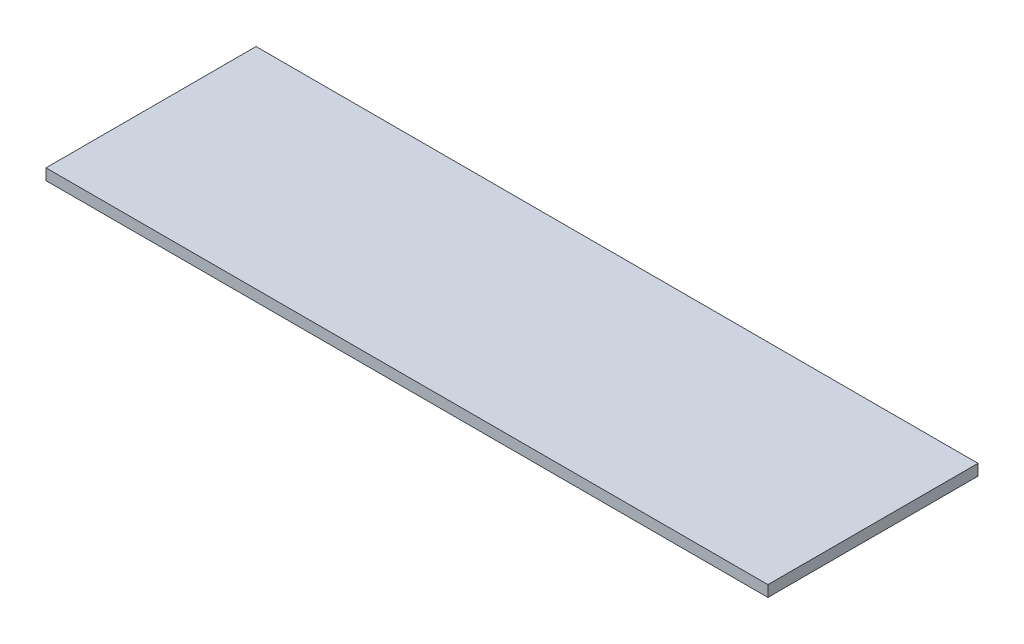
from build123d import *

# Parameters (mm, degrees)
SKETCH1_W           = 309
SKETCH1_H           = 89.916
BOSS_EXTRUDE2_DEPTH = 4.7625


with BuildPart() as part:
    # Sketch1 → Boss-Extrude2 (new body)
    with BuildSketch(Plane(origin=(0, 0, 0), x_dir=(1, 0, 0), z_dir=(0, 1, 0))):
        with Locations((95.371051813, 16.557481579)):
            Rectangle(SKETCH1_W, SKETCH1_H)
    extrude(amount=BOSS_EXTRUDE2_DEPTH)


solid = part.part
